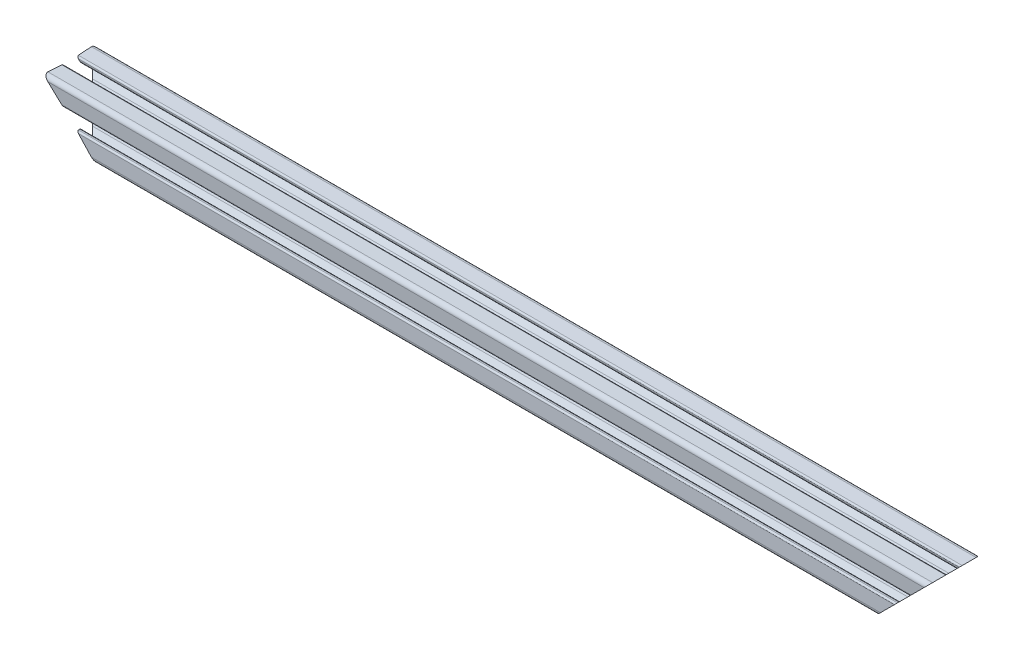
from build123d import *

# Parameters (mm, degrees)
BOSS_EXTRUDE1_DEPTH      = 215.526147
BOSS_EXTRUDE1_DEPTH_BACK = 215.526147
CUT_EXTRUDE2_DEPTH       = 218.388838628
CUT_EXTRUDE2_DEPTH_BACK  = 218.388838628
CUT_EXTRUDE3_DEPTH       = 218.388838628
CUT_EXTRUDE3_DEPTH_BACK  = 218.388838628


with BuildPart() as part:
    # Sketch3 → Boss-Extrude1 (new, two sides: drawn at the far end of the back side and taken through both)
    with BuildSketch(Plane(origin=(0, 0, 0), x_dir=(0, 0, -1), z_dir=(1, 0, 0)).offset(-BOSS_EXTRUDE1_DEPTH_BACK)):
        with BuildLine():
            Line((0, 4.826), (1.984228399, 4.826))
            ThreePointArc((1.984228399, 4.826), (3.199248297, 5.067682484), (4.229292429, 5.75593597))
            Line((4.229292429, 5.75593597), (7.586577723, 9.113221264))
            ThreePointArc((7.586577723, 9.113221264), (7.746562132, 9.955883421), (7.021168939, 10.413572441))
            Line((7.021168939, 10.413572441), (4.090593416, 10.311234489))
            ThreePointArc((4.090593416, 10.311234489), (3.534670322, 10.524633371), (3.302, 11.072770299))
            Line((3.302, 11.072770299), (3.302, 11.70815736))
            ThreePointArc((3.302, 11.70815736), (3.515863072, 12.237487038), (4.037406584, 12.46969317))
            Line((4.037406584, 12.46969317), (10.597084223, 12.698762161))
            ThreePointArc((10.597084223, 12.698762161), (12.104840979, 12.104840979), (12.698762161, 10.597084223))
            Line((12.698762161, 10.597084223), (12.46969317, 4.037406584))
            ThreePointArc((12.46969317, 4.037406584), (12.237487038, 3.515863072), (11.70815736, 3.302))
            Line((11.70815736, 3.302), (11.072770299, 3.302))
            ThreePointArc((11.072770299, 3.302), (10.524633371, 3.534670322), (10.311234489, 4.090593416))
            Line((10.311234489, 4.090593416), (10.413572441, 7.021168939))
            ThreePointArc((10.413572441, 7.021168939), (9.955883421, 7.746562132), (9.113221264, 7.586577723))
            Line((9.113221264, 7.586577723), (5.75593597, 4.229292429))
            ThreePointArc((5.75593597, 4.229292429), (5.067682484, 3.199248297), (4.826, 1.984228399))
            Line((4.826, 1.984228399), (4.826, 0))
            Line((4.826, 0), (2.54, 0))
            ThreePointArc((2.54, 0), (1.796051224, 1.796051224), (0, 2.54))
            Line((0, 2.54), (0, 4.826))
        make_face()
    extrude(amount=BOSS_EXTRUDE1_DEPTH + BOSS_EXTRUDE1_DEPTH_BACK)

    # Mirror1: part across plane


with BuildPart() as part_1:
    add(part.part)
    add(part.part.mirror(Plane.ZX))

    # Mirror2: part across plane


with BuildPart() as part_2:
    add(part_1.part)
    add(part_1.part.mirror(Plane.XY))

    # Sketch13 → Cut-Extrude2 (cut, two sides: drawn at the far end of the back side and taken through both)
    with BuildSketch(Plane(origin=(0, 0, -12.698762161), x_dir=(-1, 0, 0), z_dir=(0, 0, -1)).offset(-CUT_EXTRUDE2_DEPTH_BACK)):
        Polygon((-833.300812031, 630.382299777), (-215.526146906, 12.7), (-190.126146906, -12.69620237), (427.64851822, -630.378502147), (-807.716081334, -1865.927832398), (-2068.665411586, -605.167030474), align=None)
    extrude(amount=CUT_EXTRUDE2_DEPTH + CUT_EXTRUDE2_DEPTH_BACK, mode=Mode.SUBTRACT)

    # Sketch16 → Cut-Extrude3 (cut, two sides: drawn at the far end of the back side and taken through both)
    with BuildSketch(Plane(origin=(0, 0, -12.698762161), x_dir=(-1, 0, 0), z_dir=(0, 0, -1)).offset(-CUT_EXTRUDE3_DEPTH_BACK)):
        Polygon((215.526146906, -886.298616536), (215.526146906, -12.698762161), (215.526146906, 12.702063115), (190.126146906, -12.698762161), (-427.592198896, -630.437178341), (-1073.468846893, -2253.87494365), (-430.350501092, -2509.736381844), align=None)
    extrude(amount=CUT_EXTRUDE3_DEPTH + CUT_EXTRUDE3_DEPTH_BACK, mode=Mode.SUBTRACT)


solid = part_2.part
